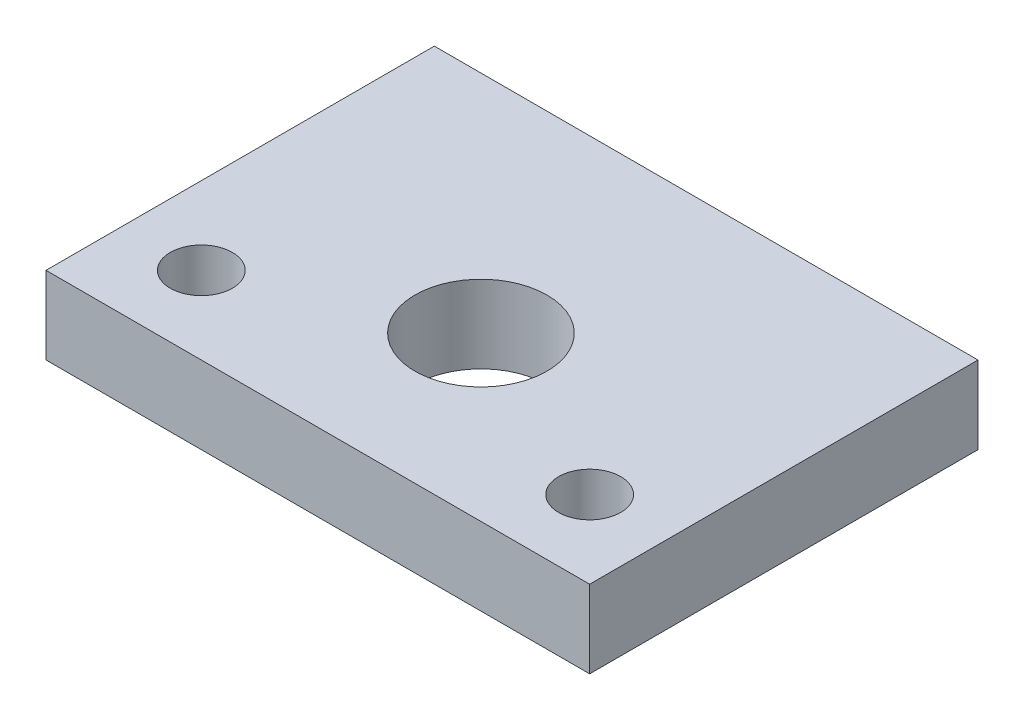
from build123d import *

# Parameters (mm, degrees)
SKETCH2_W           = 70
SKETCH2_H           = 50
BOSS_EXTRUDE1_DEPTH = 10
SKETCH3_R           = 4
CUT_EXTRUDE1_DEPTH  = 45.158804332
SKETCH5_R           = 8.5
CUT_EXTRUDE3_DEPTH  = 45.158804332


with BuildPart() as part:
    # Sketch2 → Boss-Extrude1 (new body)
    with BuildSketch(Plane(origin=(0, 0, 0), x_dir=(1, 0, 0), z_dir=(0, 1, 0))):
        Rectangle(SKETCH2_W, SKETCH2_H)
    extrude(amount=BOSS_EXTRUDE1_DEPTH)

    # Sketch3 → Cut-Extrude1 (cut, through all)
    with BuildSketch(Plane.XZ):
        with Locations(Location((-25, 15, 0), (0, 0, 270))):
            Circle(SKETCH3_R)
        with Locations(Location((25, 15, 0), (0, 0, 90))):
            Circle(SKETCH3_R)
    extrude(amount=-CUT_EXTRUDE1_DEPTH, mode=Mode.SUBTRACT)

    # Sketch5 → Cut-Extrude3 (cut, through all)
    with BuildSketch(Plane.XZ):
        with Locations(Location((0, 4, 0), (0, 0, 270))):
            Circle(SKETCH5_R)
    extrude(amount=-CUT_EXTRUDE3_DEPTH, mode=Mode.SUBTRACT)


solid = part.part
